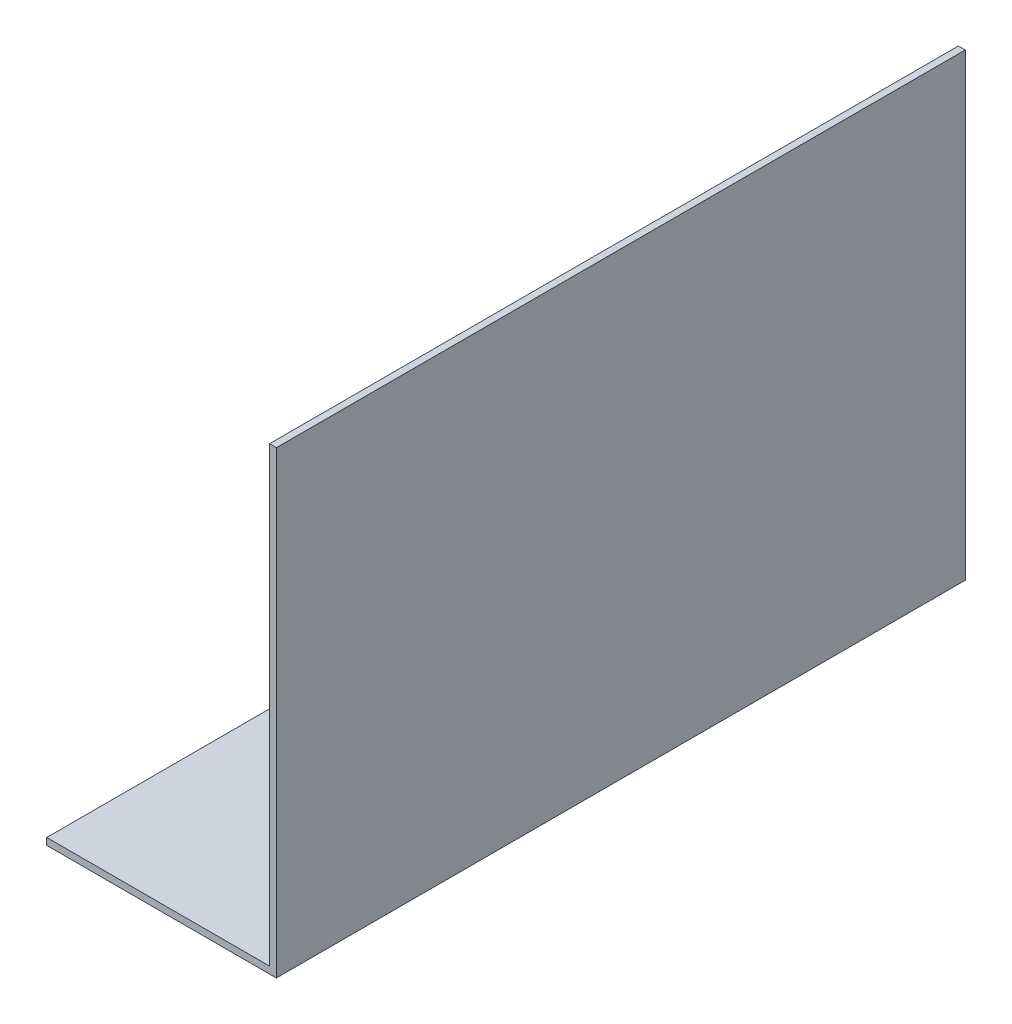
from build123d import *

# Parameters (mm, degrees)
BOSS_EXTRU_1_DEPTH = 150


with BuildPart() as part:
    # Esquisse1 → Boss.-Extru.1 (new body)
    with BuildSketch(Plane.XY):
        Polygon((0, 0), (48.5, 0), (48.5, 98.5), (50, 98.5), (50, -1.5), (0, -1.5), align=None)
    extrude(amount=BOSS_EXTRU_1_DEPTH)


solid = part.part
